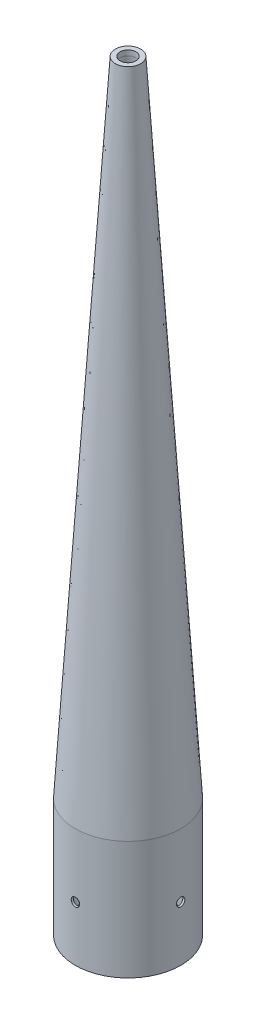
from build123d import *

# Parameters (mm, degrees)
SHELL1_T            = -3.81
SKETCH2_R           = 39.624
BOSS_EXTRUDE1_DEPTH = 88.9
SKETCH4_R           = 38.1
CUT_EXTRUDE1_DEPTH  = 88.9
SKETCH5_R           = 34.539650962
CUT_EXTRUDE2_DEPTH  = 575.240692351
SKETCH7_R           = 5.930093594
CUT_EXTRUDE5_DEPTH  = 571.44899759
SKETCH8_R           = 3.175
CUT_EXTRUDE6_DEPTH  = 486.842446429
CIRPATTERN1_COUNT   = 4


with BuildPart() as part:
    # Sketch1 → Revolve1 (revolve)
    with BuildSketch(Plane.XY, mode=Mode.PRIVATE) as revolve1_sk:
        Polygon((0, 0), (-39.624, 0), (0, 635), align=None)
    revolve(revolve1_sk.sketch.rotate(Axis((0, 635, 0), (0, -1, 0)), 180), axis=Axis((0, 635, 0), (0, -1, 0)))


with BuildPart() as body_2:
    # Split1: the piece on the far side of the plane
    add(part.part)
    split(bisect_by=Plane.ZX.offset(482.6), keep=Keep.BOTTOM)

    # Shell1
    shell1_openings = [body_2.faces().sort_by_distance(p)[0] for p in [
        (0, 0, 0),
    ]]
    offset(amount=SHELL1_T, openings=shell1_openings, kind=Kind.INTERSECTION)

    # Sketch2 → Boss-Extrude1 (add)
    with BuildSketch(Plane.XZ):
        Circle(SKETCH2_R)
    extrude(amount=BOSS_EXTRUDE1_DEPTH)

    # Sketch4 → Cut-Extrude1 (cut)
    with BuildSketch(Plane.XZ.offset(88.9)):
        Circle(SKETCH4_R)
    extrude(amount=-CUT_EXTRUDE1_DEPTH, mode=Mode.SUBTRACT)

    # Sketch7 → Cut-Extrude5 (cut, through all)
    with BuildSketch(Plane(origin=(0, 478.79, 0), x_dir=(-1, 0, 0), z_dir=(0, -1, 0))):
        with Locations(Location((0, 0, 0), (0, 0, 90))):
            Circle(SKETCH7_R)
    extrude(amount=-CUT_EXTRUDE5_DEPTH, mode=Mode.SUBTRACT)

    # Sketch8 → Cut-Extrude6 (cut, through all)
    with BuildSketch(Plane(origin=(0, 0, 0), x_dir=(0, 0, -1), z_dir=(1, 0, 0))):
        with Locations(Location((0, -47.625, 0), (0, 0, 270))):
            Circle(SKETCH8_R)
    cut_extrude6 = extrude(amount=CUT_EXTRUDE6_DEPTH, mode=Mode.SUBTRACT)

    # CirPattern1: Cut-Extrude6 ×4 about axis
    cirpattern1_axis = Axis((0, -88.9, 0), (0, 1, 0))
    for i in range(1, CIRPATTERN1_COUNT):
        add(cut_extrude6.rotate(cirpattern1_axis, i * 360 / CIRPATTERN1_COUNT), mode=Mode.SUBTRACT)


with BuildPart() as part_1:
    add(part.part)

    # Split1
    split(bisect_by=Plane.ZX.offset(482.6), keep=Keep.TOP)

    # Sketch5 → Cut-Extrude2 (cut, through all)
    with BuildSketch(Plane(origin=(0, 482.6, 0), x_dir=(1, 0, 0), z_dir=(0, 1, 0))):
        Circle(SKETCH5_R)
    extrude(amount=CUT_EXTRUDE2_DEPTH, mode=Mode.SUBTRACT)


solid = body_2.part
